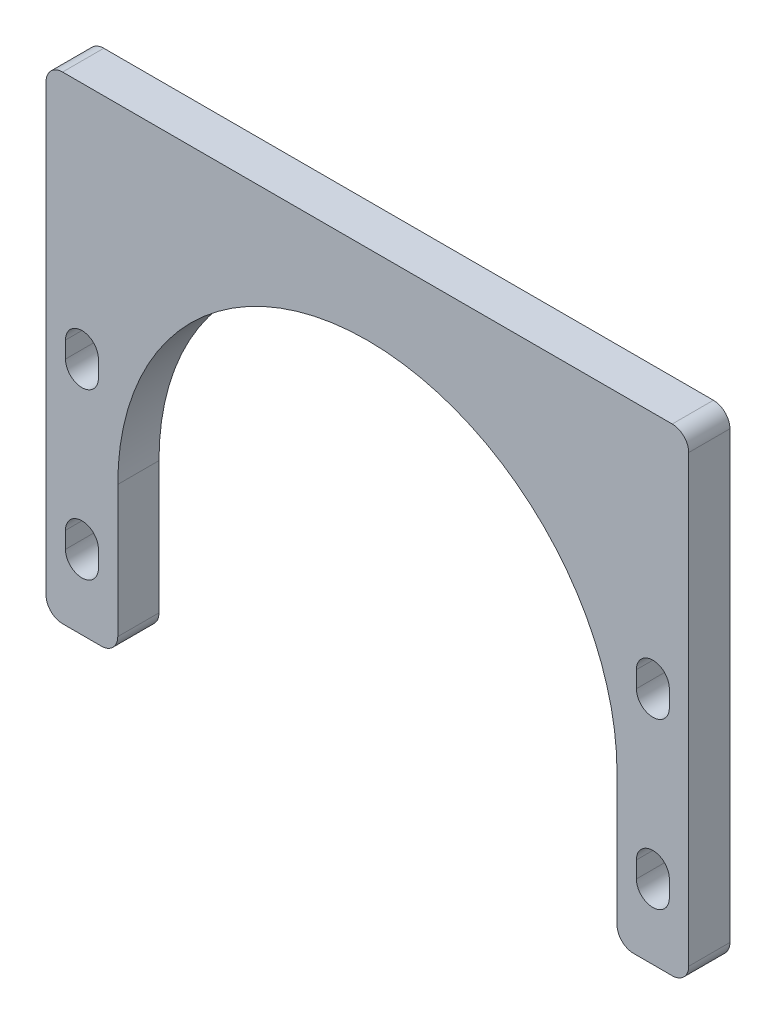
from build123d import *

# Parameters (mm, degrees)
SKETCH_1_R          = 2
SKETCH_1_W          = 8.7
SKETCH_1_H          = 18
EXTRUDE_1_DEPTH     = 5
FILLET_1_R          = 2
CUT_EXTRUDE_1_REACH = 58.089


with BuildPart() as part:
    # 草图1 → 凸台-拉伸1 (new body)
    # profile 1 of 3: a face of its own
    with BuildSketch(Plane.XY):
        with BuildLine():
            Line((39, 40), (-39, 40))
            Line((-39, 40), (-39, 0))
            Line((-39, 0), (-30.3, 0))
            ThreePointArc((-30.3, 0), (0, 30.3), (30.3, 0))
            Line((30.3, 0), (39, 0))
            Line((39, 0), (39, 40))
        make_face()
        with Locations((-34.65, 10)):
            Circle(SKETCH_1_R, mode=Mode.SUBTRACT)
        with Locations((34.65, 10)):
            Circle(SKETCH_1_R, mode=Mode.SUBTRACT)
    # profile 2 of 3: a face of its own
    with BuildSketch(Plane.XY):
        with Locations((-34.65, -9)):
            Rectangle(SKETCH_1_W, SKETCH_1_H)
        with Locations((-34.65, -10)):
            Circle(SKETCH_1_R, mode=Mode.SUBTRACT)
    # profile 3 of 3: a face of its own
    with BuildSketch(Plane.XY):
        with Locations((34.65, -9)):
            Rectangle(SKETCH_1_W, SKETCH_1_H)
        with Locations((34.65, -10)):
            Circle(SKETCH_1_R, mode=Mode.SUBTRACT)
    extrude(amount=EXTRUDE_1_DEPTH)

    # 圆角1
    fillet_1_edges = [part.edges().sort_by_distance(p)[0] for p in [
        (-30.3, -18, 2.5),
        (-39, -18, 2.5),
        (-39, 40, 2.5),
        (39, 40, 2.5),
        (39, -18, 2.5),
        (30.3, -18, 2.5),
    ]]
    fillet(fillet_1_edges, radius=FILLET_1_R)

    # 草图2 → 切除-拉伸1 (cut, up to next)
    with BuildSketch(Plane.XY.offset(5), mode=Mode.PRIVATE) as cut_extrude_1_sk1:
        with BuildLine():
            Line((-36.65, 10), (-36.65, 12))
            ThreePointArc((-36.65, 12), (-34.65, 14), (-32.65, 12))
            Line((-32.65, 12), (-32.65, 10))
            Line((-32.65, 10), (-36.65, 10))
        make_face()
    cut_extrude_1_tool1 = extrude(cut_extrude_1_sk1.sketch, amount=-CUT_EXTRUDE_1_REACH, mode=Mode.PRIVATE) & part.part
    # 草图2 → 切除-拉伸1 (cut, up to next)
    with BuildSketch(Plane.XY.offset(5), mode=Mode.PRIVATE) as cut_extrude_1_sk2:
        with BuildLine():
            Line((-36.65, -10), (-36.65, -8))
            ThreePointArc((-36.65, -8), (-34.65, -6), (-32.65, -8))
            Line((-32.65, -8), (-32.65, -10))
            Line((-32.65, -10), (-36.65, -10))
        make_face()
    cut_extrude_1_tool2 = extrude(cut_extrude_1_sk2.sketch, amount=-CUT_EXTRUDE_1_REACH, mode=Mode.PRIVATE) & part.part
    cut_extrude_1_1 = cut_extrude_1_tool1.solids().sort_by_distance((-34.65, 11.8133, 5))[0]
    add(cut_extrude_1_1, mode=Mode.SUBTRACT)
    cut_extrude_1_2 = cut_extrude_1_tool2.solids().sort_by_distance((-34.65, -8.1867, 5))[0]
    add(cut_extrude_1_2, mode=Mode.SUBTRACT)
    cut_extrude_1 = cut_extrude_1_1 + cut_extrude_1_2  # 切除-拉伸1 as one shape, for the pattern or mirror that repeats it

    # 镜向1: 切除-拉伸1 across plane
    add(cut_extrude_1.mirror(Plane(origin=(0, 0, 0), x_dir=(0, 0, 1), z_dir=(1, 0, 0))), mode=Mode.SUBTRACT)


solid = part.part
